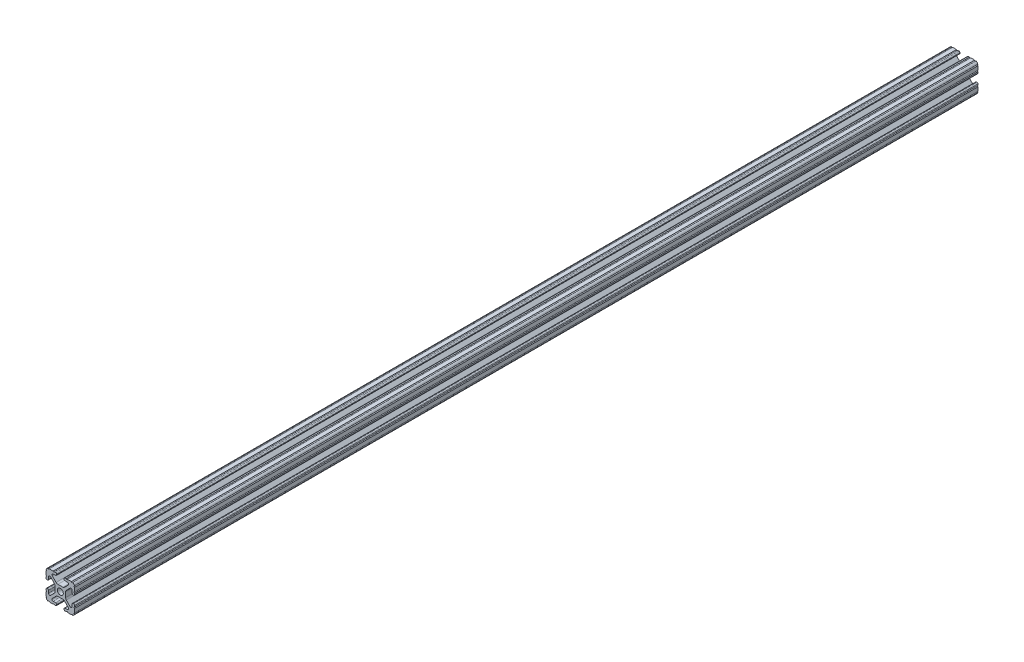
from build123d import *

# Parameters (mm, degrees)
BOSS_EXTRUDE1_DEPTH     = 400.05
CUT_EXTRUDE1_DEPTH      = 401.452971646
CUT_EXTRUDE1_DEPTH_BACK = 401.452971646
SKETCH5_R               = 0.55245


with BuildPart() as part:
    # Sketch4 → Boss-Extrude1 (new, symmetric)
    with BuildSketch(Plane.XY):
        with BuildLine():
            Line((4.190365, -12.7), (10.11729625, -12.7))
            ThreePointArc((10.11729625, -12.7), (11.943543585, -11.943543585), (12.7, -10.11729625))
            Line((12.7, -10.11729625), (12.7, -4.190365))
            ThreePointArc((12.7, -4.190365), (12.42492494, -3.52627506), (11.760835, -3.2512))
            Line((11.760835, -3.2512), (11.429365, -3.2512))
            ThreePointArc((11.429365, -3.2512), (10.76527506, -3.52627506), (10.4902, -4.190365))
            Line((10.4902, -4.190365), (10.4902, -6.348478019))
            ThreePointArc((10.4902, -6.348478019), (9.830707141, -7.335478831), (8.666460301, -7.103895736))
            Line((8.666460301, -7.103895736), (5.299899128, -3.737334563))
            ThreePointArc((5.299899128, -3.737334563), (4.817571085, -3.015479634), (4.6482, -2.16399369))
            Line((4.6482, -2.16399369), (4.6482, 0))
            Line((4.6482, 0), (2.6035, 0))
            ThreePointArc((2.6035, 0), (1.840952505, -1.840952505), (0, -2.6035))
            Line((0, -2.6035), (0, -4.6482))
            Line((0, -4.6482), (2.16399369, -4.6482))
            ThreePointArc((2.16399369, -4.6482), (3.015479634, -4.817571085), (3.737334563, -5.299899128))
            Line((3.737334563, -5.299899128), (7.103895736, -8.666460301))
            ThreePointArc((7.103895736, -8.666460301), (7.335478831, -9.830707141), (6.348478019, -10.4902))
            Line((6.348478019, -10.4902), (4.190365, -10.4902))
            ThreePointArc((4.190365, -10.4902), (3.52627506, -10.76527506), (3.2512, -11.429365))
            Line((3.2512, -11.429365), (3.2512, -11.760835))
            ThreePointArc((3.2512, -11.760835), (3.52627506, -12.42492494), (4.190365, -12.7))
        make_face()
    extrude(amount=BOSS_EXTRUDE1_DEPTH, both=True)

    # Sketch5 → Cut-Extrude1 (cut, two sides: drawn at the far end of the back side and taken through both)
    with BuildSketch(Plane.XY.offset(-CUT_EXTRUDE1_DEPTH_BACK)):
        with Locations((10.356153152, -12.7)):
            Circle(SKETCH5_R)
        with Locations((5.796028019, -12.7)):
            Circle(SKETCH5_R)
        with Locations((12.7, -10.356153152)):
            Circle(SKETCH5_R)
        with Locations((12.7, -5.796028019)):
            Circle(SKETCH5_R)
    extrude(amount=CUT_EXTRUDE1_DEPTH + CUT_EXTRUDE1_DEPTH_BACK, mode=Mode.SUBTRACT)

    # Mirror1: part across plane


with BuildPart() as part_1:
    add(part.part)
    add(part.part.mirror(Plane(origin=(0, 0, 0), x_dir=(0, 0, 1), z_dir=(1, 0, 0))))

    # Mirror2: part across plane


with BuildPart() as part_2:
    add(part_1.part)
    add(part_1.part.mirror(Plane.ZX))


solid = part_2.part
